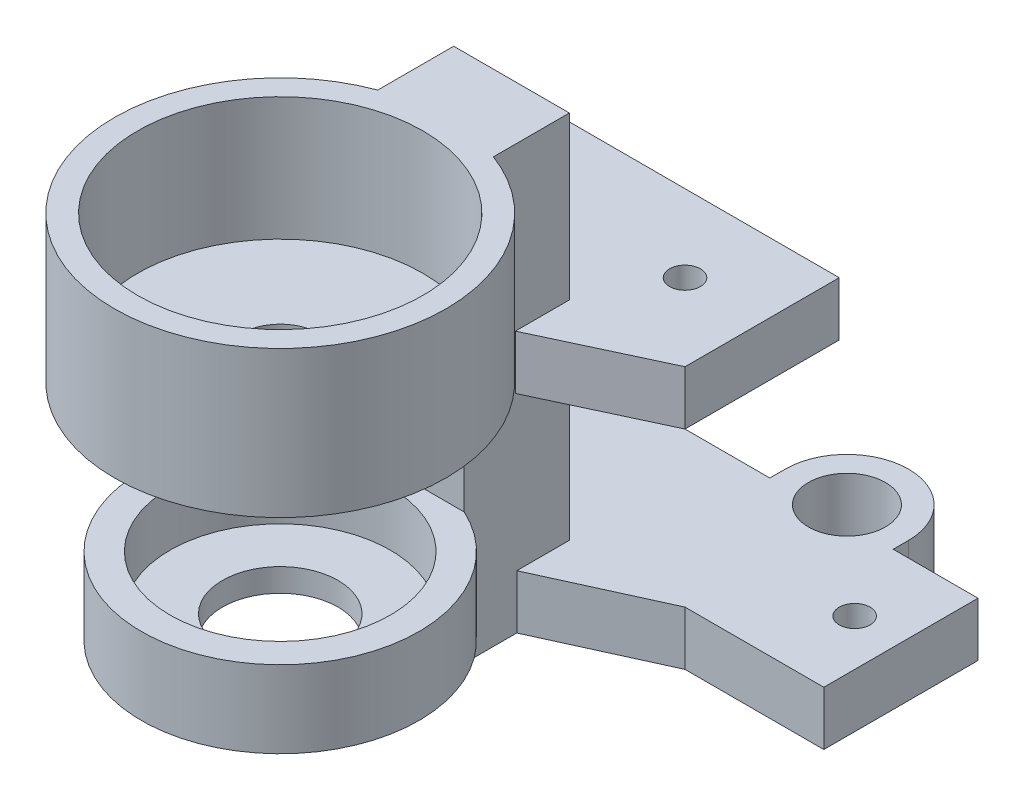
from build123d import *
from build123d.topology import SkipClean

# Parameters (mm, degrees)
ESQUISSE1_W              = 36
ESQUISSE1_H              = 20
BOSS_EXTRU_1_DEPTH       = 5
ESQUISSE2_W              = 15
ESQUISSE2_H              = 10.591208458
ESQUISSE2_H_2            = 4
BOSS_EXTRU_2_DEPTH       = 32
ESQUISSE3_R              = 5
BOSS_EXTRU_3_DEPTH       = 6
ESQUISSE4_R              = 21.5
ESQUISSE4_R_2            = 18.5
BOSS_EXTRU_4_DEPTH       = 16
BOSS_EXTRU_5_START       = -3
ESQUISSE5_R              = 21.5
ESQUISSE5_R_2            = 7.5
BOSS_EXTRU_5_DEPTH       = 3
ESQUISSE6_W              = 15
ESQUISSE6_H              = 3.413220749
BOSS_EXTRU_6_DEPTH       = 16
ESQUISSE8_R              = 2
ENL_V_MAT_EXTRU_1_DEPTH  = 16
ESQUISSE9_W              = 15
ESQUISSE9_H              = 10
BOSS_EXTRU_7_DEPTH       = 30
BOSS_EXTRU_8_START       = -10
ESQUISSE10_R             = 21.5
ESQUISSE10_R_2           = 15
BOSS_EXTRU_8_DEPTH       = 10
ESQUISSE11_R             = 15
ESQUISSE11_R_2           = 7.5
BOSS_EXTRU_9_DEPTH       = 3
ESQUISSE12_R             = 15
ENL_V_MAT_EXTRU_2_DEPTH  = 7
ESQUISSE13_R             = 7.5
ENL_V_MAT_EXTRU_3_DEPTH  = 7
BOSS_EXTRU_10_START      = 7
ESQUISSE14_R             = 15
ESQUISSE14_R_2           = 14.295
BOSS_EXTRU_10_DEPTH      = 7
ENL_V_MAT_EXTRU_4_DEPTH  = 10
ESQUISSE16_W             = 15
ESQUISSE16_H             = 16
BOSS_EXTRU_11_DEPTH      = 22
ESQUISSE18_W             = 15
ESQUISSE18_H             = 13.636931828
BOSS_EXTRU_12_DEPTH      = 22
ESQUISSE19_W             = 36
ESQUISSE19_H             = 20
ENL_V_MAT_EXTRU_5_DEPTH  = 88.712598867
ESQUISSE20_W             = 15
ESQUISSE20_H             = 7
BOSS_EXTRU_13_DEPTH      = 20
BOSS_EXTRU_14_DEPTH      = 15
BOSS_EXTRU_14_DEPTH_BACK = 30
ESQUISSE22_W             = 27
ESQUISSE22_H             = 7
ESQUISSE23_R             = 2
ENL_V_MAT_EXTRU_6_DEPTH  = 71.862542997
ESQUISSE24_R             = 2
ESQUISSE24_W             = 15
ESQUISSE24_H             = 6.818465914
BOSS_EXTRU_15_DEPTH      = 7
ESQUISSE25_R             = 2
BOSS_EXTRU_16_DEPTH      = 7
ESQUISSE27_R             = 5
ENL_V_MAT_EXTRU_7_DEPTH  = 7
BOSS_EXTRU_18_START      = 5
ESQUISSE28_R             = 8
ESQUISSE28_R_2           = 5
BOSS_EXTRU_18_DEPTH      = 5


with BuildPart() as part:
    # Esquisse1 → Boss.-Extru.1 (new body)
    with BuildSketch(Plane(origin=(0, 0, 0), x_dir=(1, 0, 0), z_dir=(0, 1, 0))):
        with Locations((18, 10)):
            Rectangle(ESQUISSE1_W, ESQUISSE1_H)
    extrude(amount=BOSS_EXTRU_1_DEPTH)

    # Esquisse2 → Boss.-Extru.2 (add)
    with BuildSketch(Plane(origin=(0, 5, 0), x_dir=(1, 0, 0), z_dir=(0, 1, 0))):
        with Locations((18, 5.295604229)):
            Rectangle(ESQUISSE2_W, ESQUISSE2_H)
        with Locations((18, 12.591208458)):
            Rectangle(ESQUISSE2_W, ESQUISSE2_H_2)
    extrude(amount=BOSS_EXTRU_2_DEPTH)

    # Esquisse3 → Boss.-Extru.3 (add)
    with BuildSketch(Plane(origin=(0, 37, 0), x_dir=(1, 0, 0), z_dir=(0, 1, 0))):
        with BuildLine():
            Line((10.5, 14.591208458), (10.5, -30))
            ThreePointArc((10.5, -30), (18, -37.5), (25.5, -30))
            Line((25.5, -30), (25.5, 14.591208458))
            Line((25.5, 14.591208458), (10.5, 14.591208458))
        make_face()
        with Locations(Location((18, -30, 0), (0, 0, 270))):
            Circle(ESQUISSE3_R, mode=Mode.SUBTRACT)
    extrude(amount=BOSS_EXTRU_3_DEPTH)

    # Esquisse4 → Boss.-Extru.4 (add)
    with BuildSketch(Plane(origin=(0, 43, 0), x_dir=(1, 0, 0), z_dir=(0, 1, 0))):
        with Locations(Location((18, -30, 0), (0, 0, 69.583789871))):
            Circle(ESQUISSE4_R)
        with Locations(Location((18, -30, 0), (0, 0, 113.916534422))):
            Circle(ESQUISSE4_R_2, mode=Mode.SUBTRACT)
    extrude(amount=BOSS_EXTRU_4_DEPTH)

    # Esquisse5 → Boss.-Extru.5 (add)
    with BuildSketch(Plane(origin=(0, 43, 0), x_dir=(1, 0, 0), z_dir=(0, 1, 0)).offset(BOSS_EXTRU_5_START)):
        with Locations(Location((18, -30, 0), (0, 0, 69.583789871))):
            Circle(ESQUISSE5_R)
        with Locations((18, -30)):
            Circle(ESQUISSE5_R_2, mode=Mode.SUBTRACT)
    extrude(amount=BOSS_EXTRU_5_DEPTH)

    # Esquisse6 → Boss.-Extru.6 (add)
    with BuildSketch(Plane(origin=(0, 43, 0), x_dir=(1, 0, 0), z_dir=(0, 1, 0))):
        with Locations((18, 12.884598084)):
            Rectangle(ESQUISSE6_W, ESQUISSE6_H)
    extrude(amount=BOSS_EXTRU_6_DEPTH)

    # Esquisse8 → Enlèv. mat.-Extru.1 (cut)
    with BuildSketch(Plane.XZ):
        with Locations(Location((6, -10, 0), (0, 0, 270))):
            Circle(ESQUISSE8_R)
        with Locations(Location((30, -10, 0), (0, 0, 270))):
            Circle(ESQUISSE8_R)
    extrude(amount=-ENL_V_MAT_EXTRU_1_DEPTH, mode=Mode.SUBTRACT)

    # Esquisse9 → Boss.-Extru.7 (add)
    with BuildSketch(Plane.XY):
        with Locations((18, 16)):
            Rectangle(ESQUISSE9_W, ESQUISSE9_H)
    extrude(amount=BOSS_EXTRU_7_DEPTH)

    # Esquisse10 → Boss.-Extru.8 (add)
    with BuildSketch(Plane.XZ.offset(-11).offset(BOSS_EXTRU_8_START)):
        with Locations(Location((18, 30, 0), (0, 0, 290.416210129))):
            Circle(ESQUISSE10_R)
        with Locations((18, 30)):
            Circle(ESQUISSE10_R_2, mode=Mode.SUBTRACT)
    extrude(amount=BOSS_EXTRU_8_DEPTH)

    # Esquisse11 → Boss.-Extru.9 (add)
    with BuildSketch(Plane.XZ.offset(-11)):
        with Locations((18, 30)):
            Circle(ESQUISSE11_R)
        with Locations((18, 30)):
            Circle(ESQUISSE11_R_2, mode=Mode.SUBTRACT)
    extrude(amount=-BOSS_EXTRU_9_DEPTH)

    # Esquisse12 → Enlèv. mat.-Extru.2 (cut)
    with BuildSketch(Plane(origin=(0, 21, 0), x_dir=(1, 0, 0), z_dir=(0, 1, 0))):
        with Locations(Location((18, -30, 0), (0, 0, 90))):
            Circle(ESQUISSE12_R)
    extrude(amount=-ENL_V_MAT_EXTRU_2_DEPTH, mode=Mode.SUBTRACT)

    # Esquisse13 → Enlèv. mat.-Extru.3 (cut)
    with BuildSketch(Plane.XZ.offset(-11)):
        with Locations(Location((18, 30, 0), (0, 0, 270))):
            Circle(ESQUISSE13_R)
    extrude(amount=-ENL_V_MAT_EXTRU_3_DEPTH, mode=Mode.SUBTRACT)

    # Esquisse14 → Boss.-Extru.10 (add)
    with BuildSketch(Plane(origin=(0, 14, 0), x_dir=(1, 0, 0), z_dir=(0, 1, 0)).offset(BOSS_EXTRU_10_START)):
        with Locations((18, -30)):
            Circle(ESQUISSE14_R)
        with Locations(Location((18, -30, 0), (0, 0, 270))):
            Circle(ESQUISSE14_R_2, mode=Mode.SUBTRACT)
    extrude(amount=-BOSS_EXTRU_10_DEPTH)

    # Esquisse15 → Enlèv. mat.-Extru.4 (cut)
    with BuildSketch(Plane.XZ.offset(-11)):
        with BuildLine():
            ThreePointArc((39.5, 30), (5.732155854, 47.656443583), (10.5, 9.85055832))
            Line((10.5, 9.85055832), (10.5, 13.636931828))
            ThreePointArc((10.5, 13.636931828), (8.278888952, 45.149257408), (36, 30))
            ThreePointArc((36, 30), (33.149257408, 20.278888952), (25.5, 13.636931828))
            Line((25.5, 13.636931828), (25.5, 9.85055832))
            ThreePointArc((25.5, 9.85055832), (35.656443583, 17.732155854), (39.5, 30))
        make_face()
    extrude(amount=-ENL_V_MAT_EXTRU_4_DEPTH, mode=Mode.SUBTRACT)

    # Esquisse16 → Boss.-Extru.11 (add)
    with BuildSketch(Plane.XY.offset(-11.177987709)):
        with Locations((18, 51)):
            Rectangle(ESQUISSE16_W, ESQUISSE16_H)
    extrude(amount=BOSS_EXTRU_11_DEPTH)

    # Esquisse18 → Boss.-Extru.12 (add)
    with BuildSketch(Plane(origin=(0, 21, 0), x_dir=(1, 0, 0), z_dir=(0, 1, 0))):
        with Locations((18, -6.818465914)):
            Rectangle(ESQUISSE18_W, ESQUISSE18_H)
    extrude(amount=BOSS_EXTRU_12_DEPTH)

    # Esquisse19 → Enlèv. mat.-Extru.5 (cut, through all)
    with BuildSketch(Plane.XZ):
        with Locations((18, -10)):
            Rectangle(ESQUISSE19_W, ESQUISSE19_H)
    extrude(amount=-ENL_V_MAT_EXTRU_5_DEPTH, mode=Mode.SUBTRACT)

    # Esquisse20 → Boss.-Extru.13 (add)
    with BuildSketch(Plane(origin=(0, 0, 0), x_dir=(-1, 0, 0), z_dir=(0, 0, -1))):
        with Locations((-18, 34.5)):
            Rectangle(ESQUISSE20_W, ESQUISSE20_H)
    extrude(amount=BOSS_EXTRU_13_DEPTH)

    # Esquisse22 → Boss.-Extru.14 (add, two sides: drawn at the far end of the back side and taken through both)
    with BuildSketch(Plane.ZY.offset(-10.5).offset(-BOSS_EXTRU_14_DEPTH_BACK)):
        with Locations((-6.5, 34.5)):
            Rectangle(ESQUISSE22_W, ESQUISSE22_H)
    extrude(amount=BOSS_EXTRU_14_DEPTH + BOSS_EXTRU_14_DEPTH_BACK)

    # Esquisse23 → Enlèv. mat.-Extru.6 (cut, through all)
    with BuildSketch(Plane(origin=(0, 38, 0), x_dir=(1, 0, 0), z_dir=(0, 1, 0))):
        with Locations(Location((30.5, 10, 0), (0, 0, 270))):
            Circle(ESQUISSE23_R)
        with Locations(Location((5.5, 10, 0), (0, 0, 270))):
            Circle(ESQUISSE23_R)
        Polygon((-4.5, -7), (10.5, -7), (-4.5, 0), align=None)
        Polygon((40.5, -7), (40.5, 0), (25.5, -7), align=None)
    extrude(amount=-ENL_V_MAT_EXTRU_6_DEPTH, mode=Mode.SUBTRACT)

    # Esquisse24 → Boss.-Extru.15 (add)
    # profile 1 of 5: a face of its own
    with BuildSketch(Plane.XZ.offset(-11)):
        Polygon((10.5, 6.818465914), (-4.5, 0), (10.5, 0), align=None)
    # profile 2 of 5: a face of its own
    with BuildSketch(Plane.XZ.offset(-11)):
        Polygon((10.5, 0), (-4.5, 0), (-4.5, -20), (40.5, -20), (40.5, 0), (25.5, 0), align=None)
        with Locations(Location((5.5, -10, 0), (0, 0, 90))):
            Circle(ESQUISSE24_R, mode=Mode.SUBTRACT)
    # profile 3 of 5: a face of its own
    with BuildSketch(Plane.XZ.offset(-11)):
        with Locations((18, 3.409232957)):
            Rectangle(ESQUISSE24_W, ESQUISSE24_H)
    # profile 4 of 5: a face of its own
    with BuildSketch(Plane.XZ.offset(-11)):
        with Locations((18, 10.227698871)):
            Rectangle(ESQUISSE24_W, ESQUISSE24_H)
    # profile 5 of 5: a face of its own
    with BuildSketch(Plane.XZ.offset(-11)):
        Polygon((25.5, 6.818465914), (25.5, 0), (40.5, 0), align=None)
    extrude(amount=BOSS_EXTRU_15_DEPTH)

    # Esquisse25 → Boss.-Extru.16 (add)
    with BuildSketch(Plane(origin=(0, 4, 0), x_dir=(-1, 0, 0), z_dir=(0, -1, 0))):
        with BuildLine():
            Line((-34.917424305, 20), (-31.5, 20))
            Line((-31.5, 20), (-31.5, 22))
            ThreePointArc((-31.5, 22), (-39.5, 30), (-47.5, 22))
            Line((-47.5, 22), (-47.5, 20))
            Line((-47.5, 20), (-58.5, 20))
            Line((-58.5, 20), (-58.5, 0))
            Line((-58.5, 0), (-40.5, 0))
            Line((-40.5, 0), (-40.5, 17.101020514))
            ThreePointArc((-40.5, 17.101020514), (-41.804285717, 26.437371669), (-34.917424305, 20))
        make_face()
        with Locations(Location((-52.5, 10, 0), (0, 0, 90))):
            Circle(ESQUISSE25_R, mode=Mode.SUBTRACT)
    extrude(amount=-BOSS_EXTRU_16_DEPTH)

    # Esquisse27 → Enlèv. mat.-Extru.7 (cut)
    with BuildSketch(Plane.XZ.offset(-4)):
        with Locations(Location((39.5, -22, 0), (0, 0, 270))):
            Circle(ESQUISSE27_R)
    extrude(amount=-ENL_V_MAT_EXTRU_7_DEPTH, mode=Mode.SUBTRACT)

    # Esquisse28 → Boss.-Extru.18 (add)
    with SkipClean():  # the faces are left unmerged after this step: merging them gives an invalid solid
        with BuildSketch(Plane.XZ.offset(-4).offset(BOSS_EXTRU_18_START)):
            with Locations(Location((39.5, -22, 0), (0, 0, 270))):
                Circle(ESQUISSE28_R)
            with Locations(Location((39.5, -22, 0), (0, 0, 270))):
                Circle(ESQUISSE28_R_2, mode=Mode.SUBTRACT)
        extrude(amount=-BOSS_EXTRU_18_DEPTH)


solid = part.part
